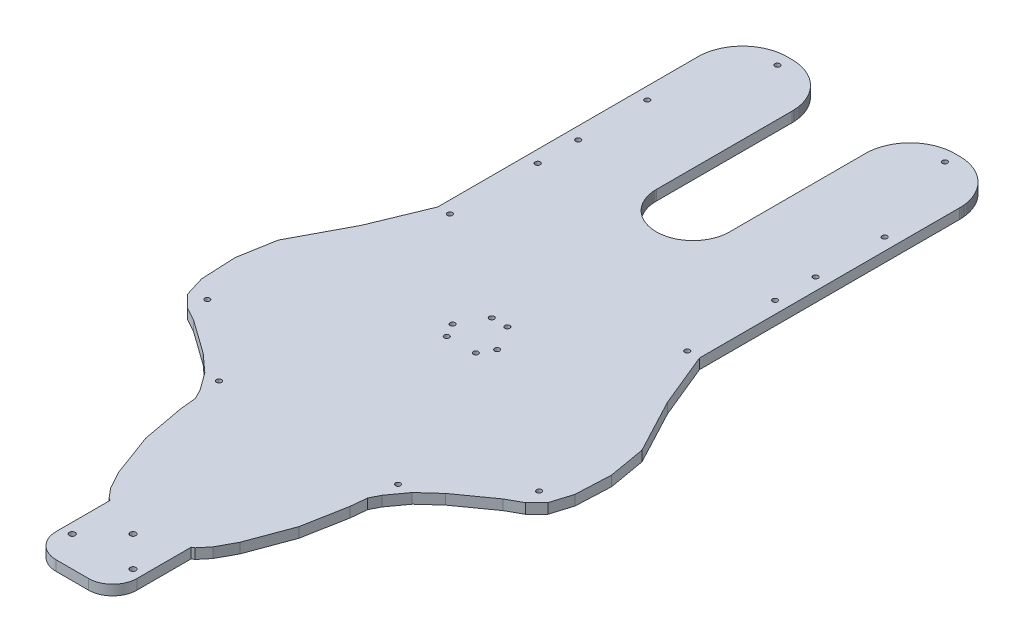
from build123d import *

# Parameters (mm, degrees)
BOSS_EXTRUDE1_DEPTH                  = 6.35
SKETCH2_W                            = 50.8
SKETCH2_H                            = 76.2
PERINEUM_SUPPORT_DEPTH               = 6.35
SKETCH3_R                            = 1.8288
HOLES_PERINEUM_SUPPORT_BRACKET_DEPTH = 6.35
SKETCH4_R                            = 1.575
HOLES_FT_SENSOR_DEPTH                = 6.35
FILLET1_R                            = 15.24
SKETCH5_R                            = 1.5875
HOLES_SNAP_BUTTONS_DEPTH             = 25.4


with BuildPart() as part:
    # Sketch1 → Boss-Extrude1 (new body)
    with BuildSketch(Plane(origin=(0, 0, 0), x_dir=(1, 0, 0), z_dir=(0, 1, 0))):
        Polygon((-1.44417, 328.045), (-2.16449, 328.102), (-2.88266, 328.181), (-3.59799, 328.283), (-4.30977, 328.407), (-5.01729, 328.554), (-5.71986, 328.723), (-6.41679, 328.913), (-7.10738, 329.126), (-7.79097, 329.36), (-8.46686, 329.615), (-9.1344, 329.892), (-9.79292, 330.189), (-10.4418, 330.507), (-11.0803, 330.845), (-11.7079, 331.203), (-12.324, 331.58), (-12.9279, 331.977), (-13.5191, 332.393), (-14.0968, 332.826), (-14.6608, 333.278), (-15.2102, 333.747), (-15.7446, 334.234), (-16.2634, 334.737), (-16.7663, 335.255), (-17.2525, 335.79), (-17.7218, 336.339), (-18.1736, 336.903), (-18.6074, 337.481), (-19.0228, 338.072), (-19.4195, 338.676), (-19.7971, 339.292), (-20.155, 339.92), (-20.4931, 340.558), (-20.811, 341.207), (-21.1084, 341.866), (-21.3849, 342.533), (-21.6402, 343.209), (-21.8743, 343.893), (-22.0867, 344.583), (-22.2774, 345.28), (-22.4461, 345.983), (-22.5926, 346.69), (-22.7168, 347.402), (-22.8186, 348.117), (-22.8979, 348.835), (-22.9546, 349.556), (-22.9886, 350.278), (-23, 351), (-23, 436), (-23.0138, 436.879), (-23.0552, 437.758), (-23.1243, 438.635), (-23.2208, 439.509), (-23.3447, 440.38), (-23.496, 441.247), (-23.6743, 442.108), (-23.8797, 442.963), (-24.1118, 443.812), (-24.3704, 444.652), (-24.6553, 445.485), (-24.9662, 446.307), (-25.3029, 447.12), (-25.6648, 447.922), (-26.0518, 448.712), (-26.4634, 449.489), (-26.8992, 450.253), (-27.3588, 451.003), (-27.8417, 451.738), (-28.3475, 452.458), (-28.8757, 453.161), (-29.4256, 453.848), (-29.9969, 454.517), (-30.5889, 455.167), (-31.201, 455.799), (-31.8327, 456.411), (-32.4833, 457.003), (-33.1521, 457.574), (-33.8386, 458.124), (-34.542, 458.652), (-35.2617, 459.158), (-35.9968, 459.641), (-36.7468, 460.101), (-37.5109, 460.537), (-38.2883, 460.948), (-39.0782, 461.335), (-39.8799, 461.697), (-40.6925, 462.034), (-41.5153, 462.345), (-42.3475, 462.63), (-43.1882, 462.888), (-44.0367, 463.12), (-44.892, 463.326), (-45.7533, 463.504), (-46.6198, 463.655), (-47.4907, 463.779), (-48.365, 463.876), (-49.2419, 463.945), (-50.1205, 463.986), (-51, 464), (-54, 464), (-54.8795, 463.986), (-55.7581, 463.945), (-56.635, 463.876), (-57.5093, 463.779), (-58.3802, 463.655), (-59.2467, 463.504), (-60.108, 463.326), (-60.9633, 463.12), (-61.8117, 462.888), (-62.6525, 462.63), (-63.4846, 462.345), (-64.3075, 462.034), (-65.1201, 461.697), (-65.9218, 461.335), (-66.7117, 460.948), (-67.4891, 460.537), (-68.2532, 460.101), (-69.0031, 459.641), (-69.7383, 459.158), (-70.458, 458.652), (-71.1614, 458.124), (-71.8479, 457.574), (-72.5167, 457.003), (-73.1673, 456.411), (-73.799, 455.799), (-74.4111, 455.167), (-75.0031, 454.517), (-75.5744, 453.848), (-76.1243, 453.161), (-76.6525, 452.458), (-77.1582, 451.738), (-77.6412, 451.003), (-78.1008, 450.253), (-78.5366, 449.489), (-78.9482, 448.712), (-79.3351, 447.922), (-79.6971, 447.12), (-80.0337, 446.307), (-80.3447, 445.485), (-80.6296, 444.652), (-80.8882, 443.812), (-81.1203, 442.963), (-81.3257, 442.108), (-81.504, 441.247), (-81.6553, 440.38), (-81.7792, 439.509), (-81.8757, 438.635), (-81.9447, 437.758), (-81.9862, 436.879), (-82, 436), (-82, 273), (-96, 239), (-114, 205), (-118, 182), (-117, 160), (-113, 147), (-106, 140), (-97, 135), (-76, 120), (-65, 110), (-57, 99), (-54, 93), (-53, 83), (-48, 56), (-38, 29), (-32, 18), (-27, 12), (-19, 7), (-11, 3), (-5, 1), (0, 0), (5, 1), (11, 3), (19, 7), (27, 12), (32, 18), (38, 29), (48, 56), (53, 83), (54, 93), (57, 99), (65, 110), (76, 120), (97, 135), (106, 140), (113, 147), (117, 160), (118, 182), (114, 205), (96, 239), (82, 273), (82, 436), (81.9862, 436.879), (81.9447, 437.758), (81.8757, 438.635), (81.7792, 439.509), (81.6553, 440.38), (81.504, 441.247), (81.3257, 442.108), (81.1203, 442.963), (80.8882, 443.812), (80.6296, 444.652), (80.3447, 445.485), (80.0337, 446.307), (79.6971, 447.12), (79.3351, 447.922), (78.9482, 448.712), (78.5366, 449.489), (78.1008, 450.253), (77.6412, 451.003), (77.1582, 451.738), (76.6525, 452.458), (76.1243, 453.161), (75.5744, 453.848), (75.0031, 454.517), (74.4111, 455.167), (73.799, 455.799), (73.1673, 456.411), (72.5167, 457.003), (71.8479, 457.574), (71.1614, 458.124), (70.458, 458.652), (69.7383, 459.158), (69.0031, 459.641), (68.2532, 460.101), (67.4891, 460.537), (66.7117, 460.948), (65.9218, 461.335), (65.1201, 461.697), (64.3075, 462.034), (63.4846, 462.345), (62.6525, 462.63), (61.8117, 462.888), (60.9633, 463.12), (60.108, 463.326), (59.2467, 463.504), (58.3802, 463.655), (57.5093, 463.779), (56.635, 463.876), (55.7581, 463.945), (54.8795, 463.986), (54, 464), (51, 464), (50.1205, 463.986), (49.2419, 463.945), (48.365, 463.876), (47.4907, 463.779), (46.6198, 463.655), (45.7533, 463.504), (44.892, 463.326), (44.0367, 463.12), (43.1882, 462.888), (42.3475, 462.63), (41.5153, 462.345), (40.6925, 462.034), (39.8799, 461.697), (39.0782, 461.335), (38.2883, 460.948), (37.5109, 460.537), (36.7468, 460.101), (35.9968, 459.641), (35.2617, 459.158), (34.542, 458.652), (33.8386, 458.124), (33.1521, 457.574), (32.4833, 457.003), (31.8327, 456.411), (31.201, 455.799), (30.5889, 455.167), (29.9969, 454.517), (29.4256, 453.848), (28.8757, 453.161), (28.3475, 452.458), (27.8417, 451.738), (27.3588, 451.003), (26.8992, 450.253), (26.4634, 449.489), (26.0518, 448.712), (25.6648, 447.922), (25.3029, 447.12), (24.9662, 446.307), (24.6553, 445.485), (24.3704, 444.652), (24.1118, 443.812), (23.8797, 442.963), (23.6743, 442.108), (23.496, 441.247), (23.3447, 440.38), (23.2208, 439.509), (23.1243, 438.635), (23.0552, 437.758), (23.0138, 436.879), (23, 436), (23, 351), (22.9886, 350.278), (22.9546, 349.556), (22.8979, 348.835), (22.8186, 348.117), (22.7168, 347.402), (22.5926, 346.69), (22.4461, 345.983), (22.2774, 345.28), (22.0867, 344.583), (21.8743, 343.893), (21.6402, 343.209), (21.3849, 342.533), (21.1084, 341.866), (20.811, 341.207), (20.4931, 340.558), (20.155, 339.92), (19.7971, 339.292), (19.4195, 338.676), (19.0228, 338.072), (18.6074, 337.481), (18.1736, 336.903), (17.7218, 336.339), (17.2525, 335.79), (16.7663, 335.255), (16.2634, 334.737), (15.7446, 334.234), (15.2102, 333.747), (14.6608, 333.278), (14.0968, 332.826), (13.5191, 332.393), (12.9279, 331.977), (12.324, 331.58), (11.7079, 331.203), (11.0803, 330.845), (10.4418, 330.507), (9.79292, 330.189), (9.1344, 329.892), (8.46686, 329.615), (7.79097, 329.36), (7.10738, 329.126), (6.41679, 328.913), (5.71986, 328.723), (5.01729, 328.554), (4.30977, 328.407), (3.59799, 328.283), (2.88266, 328.181), (2.16449, 328.102), (1.44417, 328.045), (0.722443, 328.011), (0, 328), (-0.722443, 328.011), align=None)
    extrude(amount=BOSS_EXTRUDE1_DEPTH)

    # Sketch2 → perineum_support (add)
    with BuildSketch(Plane.XZ):
        Rectangle(SKETCH2_W, SKETCH2_H)
    extrude(amount=-PERINEUM_SUPPORT_DEPTH)

    # Sketch3 → holes_perineum_support_bracket (cut)
    with BuildSketch(Plane(origin=(0, 6.35, 0), x_dir=(1, 0, 0), z_dir=(0, 1, 0))):
        with Locations((19.05, -19.05)):
            Circle(SKETCH3_R)
        with Locations((-19.05, -19.05)):
            Circle(SKETCH3_R)
        Circle(SKETCH3_R)
    extrude(amount=-HOLES_PERINEUM_SUPPORT_BRACKET_DEPTH, mode=Mode.SUBTRACT)

    # Sketch4 → holes_FT_sensor (cut)
    with BuildSketch(Plane(origin=(0, 6.35, 0), x_dir=(1, 0, 0), z_dir=(0, 1, 0))):
        with Locations((4.904550848, 229.749665953)):
            Circle(SKETCH4_R)
        with Locations((-4.904550848, 229.749665953)):
            Circle(SKETCH4_R)
        with Locations((9.145372123, 205.698773352)):
            Circle(SKETCH4_R)
        with Locations((14.049922971, 214.193704608)):
            Circle(SKETCH4_R)
        with Locations((-13.803722491, 214.051560695)):
            Circle(SKETCH4_R)
        with Locations((-8.899171643, 205.556629439)):
            Circle(SKETCH4_R)
    extrude(amount=-HOLES_FT_SENSOR_DEPTH, mode=Mode.SUBTRACT)

    # Fillet1
    fillet1_edges = [part.edges().sort_by_distance(p)[0] for p in [
        (25.4, 3.175, 38.1),
        (-25.4, 3.175, 38.1),
    ]]
    fillet(fillet1_edges, radius=FILLET1_R)

    # Sketch5 → holes_snap_buttons (cut)
    with BuildSketch(Plane(origin=(0, 6.35, 0), x_dir=(1, 0, 0), z_dir=(0, 1, 0))):
        with Locations((52.5, 456.38)):
            Circle(SKETCH5_R)
        with Locations((74.38, 396.69)):
            Circle(SKETCH5_R)
        with Locations((74.38, 328.009927083)):
            Circle(SKETCH5_R)
        with Locations((74.38, 273)):
            Circle(SKETCH5_R)
        with Locations((103.965320434, 150.537679004)):
            Circle(SKETCH5_R)
        with Locations((56.11, 110)):
            Circle(SKETCH5_R)
        with Locations((74.38, 353.409927083)):
            Circle(SKETCH5_R)
        with Locations((-56.11, 110)):
            Circle(SKETCH5_R)
        with Locations((-103.965320434, 150.537679004)):
            Circle(SKETCH5_R)
        with Locations((-74.38, 273)):
            Circle(SKETCH5_R)
        with Locations((-74.38, 328.009927083)):
            Circle(SKETCH5_R)
        with Locations((-74.38, 353.409927083)):
            Circle(SKETCH5_R)
        with Locations((-74.38, 396.69)):
            Circle(SKETCH5_R)
        with Locations((-52.5, 456.38)):
            Circle(SKETCH5_R)
    extrude(amount=-HOLES_SNAP_BUTTONS_DEPTH, mode=Mode.SUBTRACT)


solid = part.part
